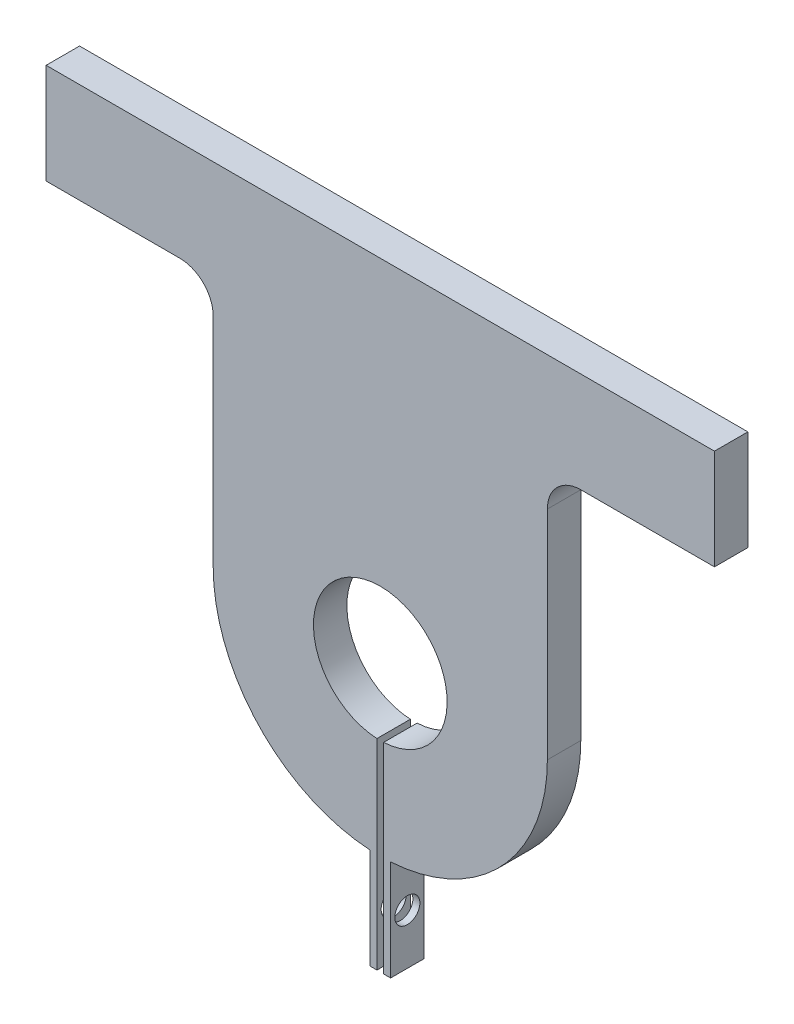
from build123d import *

# Parameters (mm, degrees)
BOSS_EXTRUDE1_DEPTH = 5.08
SKETCH4_R           = 1.905
CUT_EXTRUDE2_DEPTH  = 75.926658634


with BuildPart() as part:
    # Sketch1 → Boss-Extrude1 (new body)
    with BuildSketch(Plane.XY):
        with BuildLine():
            Line((-25.4, 0), (-25.4, 33.02))
            ThreePointArc((-25.4, 33.02), (-26.887897552, 36.612102448), (-30.48, 38.1))
            Line((-30.48, 38.1), (-50.8, 38.1))
            Line((-50.8, 38.1), (-50.8, 53.34))
            Line((-50.8, 53.34), (50.8, 53.34))
            Line((50.8, 53.34), (50.8, 38.1))
            Line((50.8, 38.1), (30.48, 38.1))
            ThreePointArc((30.48, 38.1), (26.887897552, 36.612102448), (25.4, 33.02))
            Line((25.4, 33.02), (25.4, 0))
            ThreePointArc((25.4, 0), (18.508661853, -17.395098057), (1.574060126, -25.351180145))
            Line((1.574060126, -25.351180145), (1.574060126, -40.634919492))
            Line((1.574060126, -40.634919492), (0.508, -40.634919492))
            Line((0.508, -40.634919492), (0.508, -25.394919492))
            Line((0.508, -25.394919492), (0.508, -10.147292053))
            ThreePointArc((0.508, -10.147292053), (0, 10.16), (-0.508, -10.147292053))
            Line((-0.508, -10.147292053), (-0.508, -25.394919492))
            Line((-0.508, -25.394919492), (-0.508, -40.634919492))
            Line((-0.508, -40.634919492), (-1.574060126, -40.634919492))
            Line((-1.574060126, -40.634919492), (-1.574060126, -25.351180145))
            ThreePointArc((-1.574060126, -25.351180145), (-18.508661853, -17.395098057), (-25.4, 0))
        make_face()
    extrude(amount=BOSS_EXTRUDE1_DEPTH)

    # Sketch4 → Cut-Extrude2 (cut, through all)
    with BuildSketch(Plane(origin=(1.574060126, 0, 0), x_dir=(0, 0, -1), z_dir=(1, 0, 0))):
        with Locations(Location((-2.54, -32.971180145, 0), (0, 0, 90))):
            Circle(SKETCH4_R)
    extrude(amount=-CUT_EXTRUDE2_DEPTH, mode=Mode.SUBTRACT)


solid = part.part
